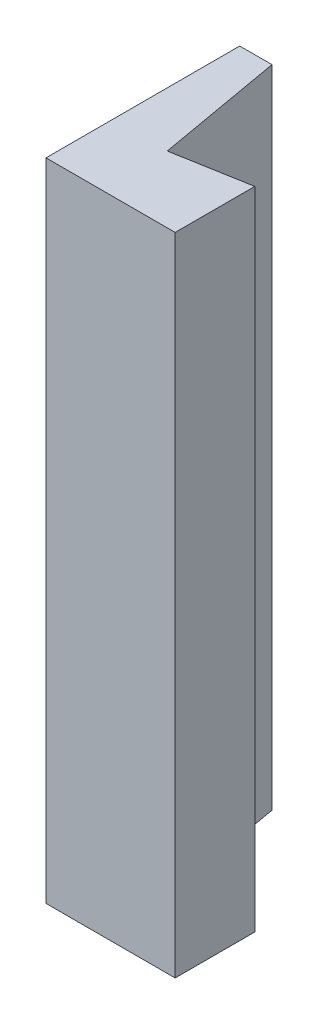
from build123d import *

# Parameters (mm, degrees)
BOSS_EXTRUDE1_DEPTH = 127


with BuildPart() as part:
    # Sketch1 → Boss-Extrude1 (new body)
    with BuildSketch(Plane(origin=(0, 0, 0), x_dir=(1, 0, 0), z_dir=(0, 1, 0))):
        Polygon((-6.35, 19.05), (-1.939336287, -5.964116927), (12.7, -3.382806959), (12.7, -19.05), (-12.7, -19.05), (-12.7, 19.05), align=None)
    extrude(amount=BOSS_EXTRUDE1_DEPTH)


solid = part.part
